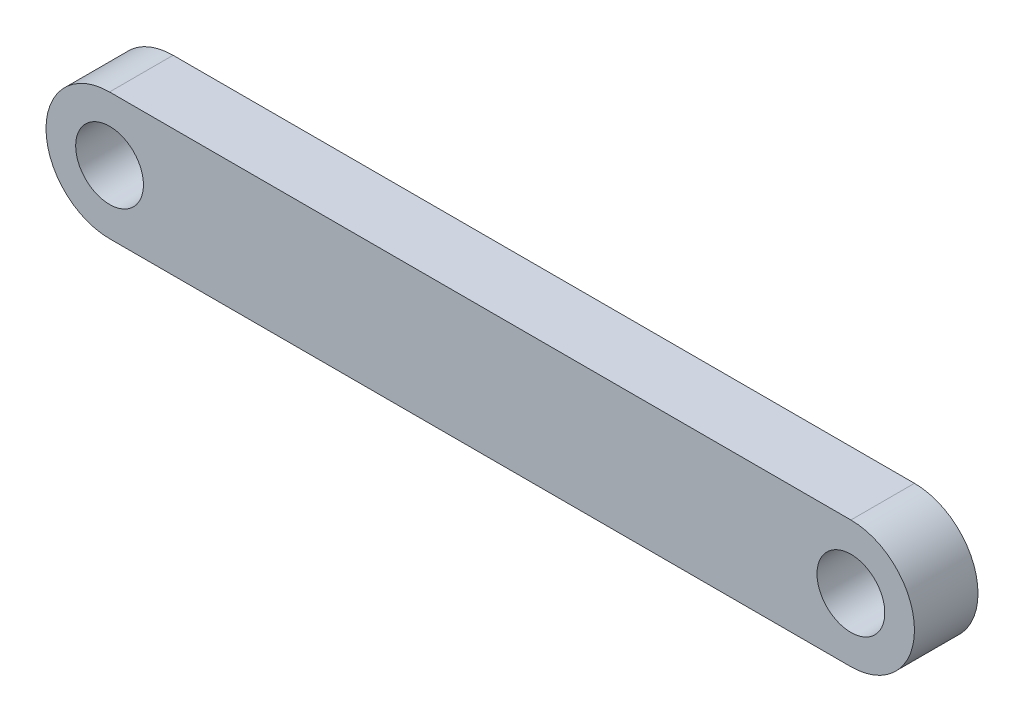
from build123d import *

# Parameters (mm, degrees)
ESQUISSE1_R        = 1.6
BOSS_EXTRU_1_DEPTH = 3


with BuildPart() as part:
    # Esquisse1 → Boss.-Extru.1 (new body)
    with BuildSketch(Plane.XY.offset(3)):
        with BuildLine():
            Line((35, 3), (0, 3))
            ThreePointArc((0, 3), (-3, 0), (0, -3))
            Line((0, -3), (35, -3))
            ThreePointArc((35, -3), (38, 0), (35, 3))
        make_face()
        with Locations(Location((35, 0, 0), (0, 0, 180))):
            Circle(ESQUISSE1_R, mode=Mode.SUBTRACT)
        with Locations(Location((0, 0, 0), (0, 0, 180))):
            Circle(ESQUISSE1_R, mode=Mode.SUBTRACT)
    extrude(amount=-BOSS_EXTRU_1_DEPTH)


solid = part.part
